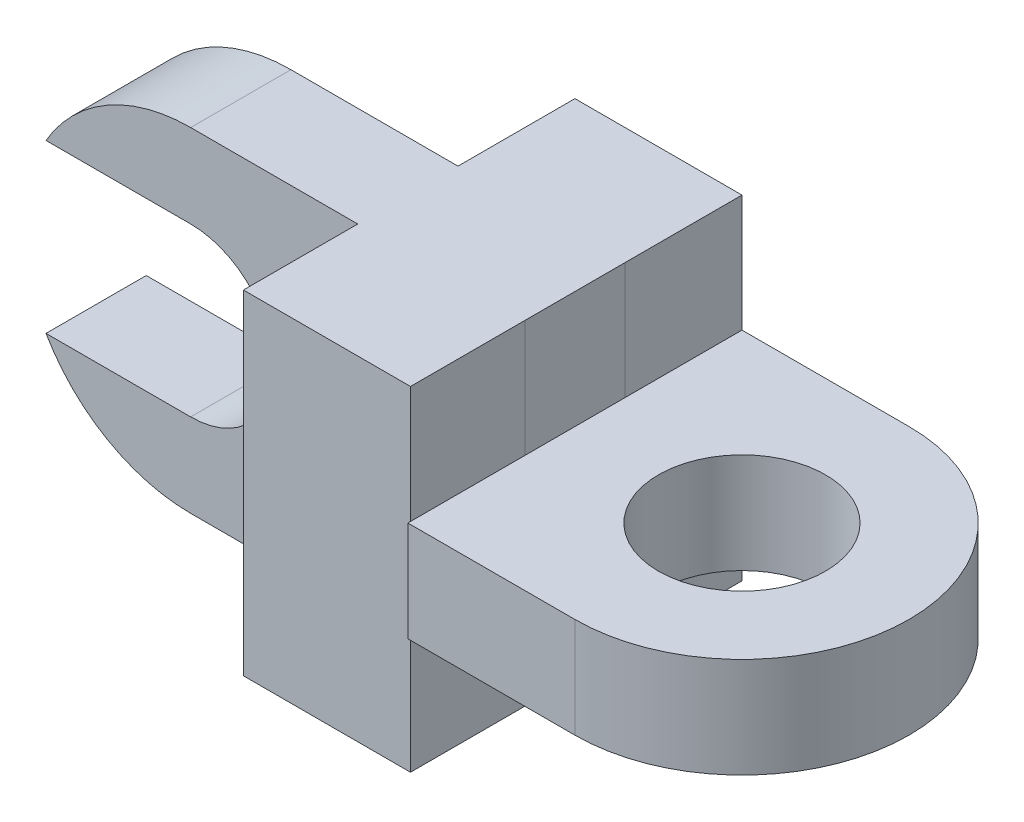
from build123d import *

# Parameters (mm, degrees)
BOSS_EXTRUDE1_DEPTH = 30
BOSS_EXTRUDE2_DEPTH = 30
CUT_EXTRUDE1_DEPTH  = 64
SKETCH4_R           = 25
CUT_EXTRUDE2_DEPTH  = 93
SKETCH6_W           = 50
SKETCH6_H           = 99.213444665
BOSS_EXTRUDE3_DEPTH = 100


with BuildPart() as part:
    # Sketch1 → Boss-Extrude1 (new body)
    with BuildSketch(Plane.XY):
        with BuildLine():
            Line((-100, 25), (-143.301270189, 25))
            ThreePointArc((-143.301270189, 25), (-125, 43.301270189), (-100, 50))
            Line((-100, 50), (0, 50))
            Line((0, 50), (0, 15))
            Line((0, 15), (100, 15))
            Line((100, 15), (100, -15))
            Line((100, -15), (0, -15))
            Line((0, -15), (0, -50))
            Line((0, -50), (-100, -50))
            ThreePointArc((-100, -50), (-125, -43.301270189), (-143.301270189, -25))
            Line((-143.301270189, -25), (-100, -25))
            ThreePointArc((-100, -25), (-75, 0), (-100, 25))
        make_face()
    extrude(amount=-BOSS_EXTRUDE1_DEPTH)

    # Sketch2 → Boss-Extrude2 (add)
    with BuildSketch(Plane(origin=(0, 15, 0), x_dir=(1, 0, 0), z_dir=(0, 1, 0))):
        with BuildLine():
            Line((49.998729811, 65), (-0.001270189, 65))
            Line((-0.001270189, 65), (-0.001270189, -35))
            Line((-0.001270189, -35), (49.998729811, -35))
            ThreePointArc((49.998729811, -35), (99.998729811, 15), (49.998729811, 65))
        make_face()
    extrude(amount=-BOSS_EXTRUDE2_DEPTH)

    # Sketch3 → Cut-Extrude1 (cut)
    with BuildSketch(Plane(origin=(0, 15, 0), x_dir=(1, 0, 0), z_dir=(0, 1, 0))):
        with BuildLine():
            Line((97.695689882, 30), (100, 30))
            Line((100, 30), (100, 0))
            Line((100, 0), (97.695689882, 0))
            ThreePointArc((97.695689882, 0), (99.998729811, 15), (97.695689882, 30))
        make_face()
    extrude(amount=-CUT_EXTRUDE1_DEPTH, mode=Mode.SUBTRACT)

    # Sketch4 → Cut-Extrude2 (cut)
    with BuildSketch(Plane(origin=(0, 15, 0), x_dir=(1, 0, 0), z_dir=(0, 1, 0))):
        with Locations(Location((49.998729811, 15, 0), (0, 0, 270))):
            Circle(SKETCH4_R)
    extrude(amount=-CUT_EXTRUDE2_DEPTH, mode=Mode.SUBTRACT)

    # Sketch6 → Boss-Extrude3 (add)
    with BuildSketch(Plane(origin=(0, 50, 0), x_dir=(1, 0, 0), z_dir=(0, 1, 0))):
        with Locations((-25.001270189, 15.393277667)):
            Rectangle(SKETCH6_W, SKETCH6_H)
    extrude(amount=-BOSS_EXTRUDE3_DEPTH)


solid = part.part
